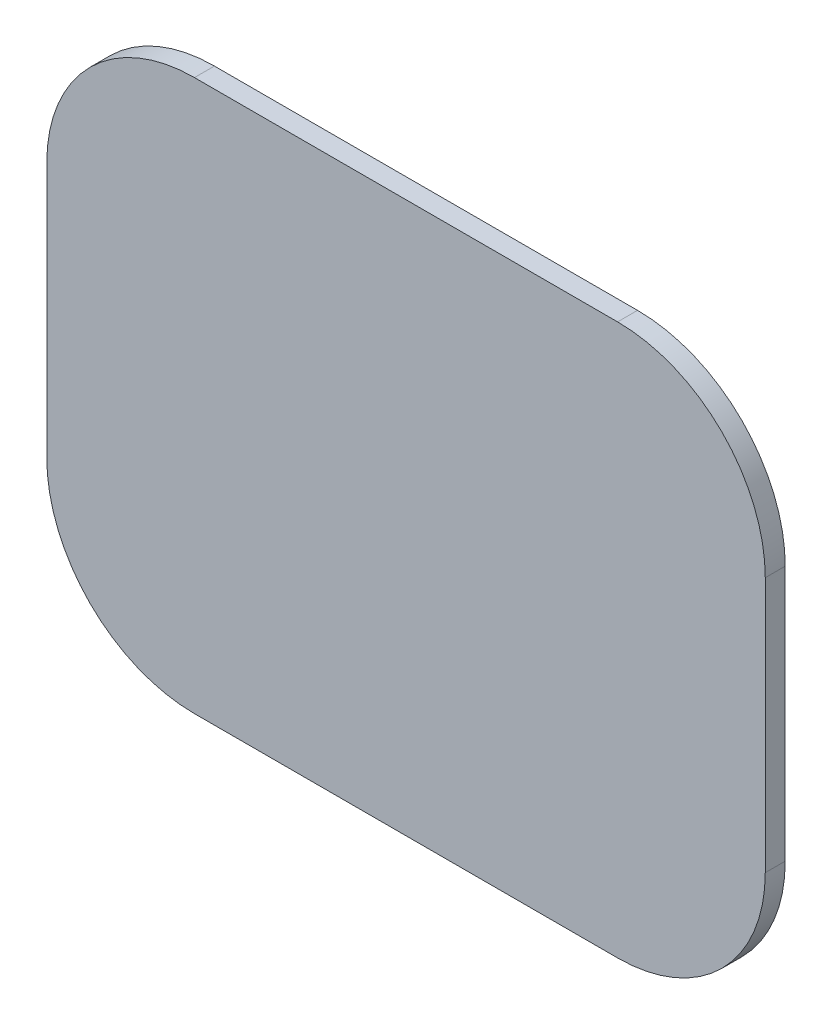
from build123d import *

# Parameters (mm, degrees)
BOSS_EXTRUDE1_START = 71.584968
BOSS_EXTRUDE1_DEPTH = 2.5
BOSS_EXTRUDE2_DEPTH = 2.5


with BuildPart() as part:
    # Sketch2 → Boss-Extrude1 (new body)
    with BuildSketch(Plane.XY.offset(-64.584967839).offset(BOSS_EXTRUDE1_START)):
        with BuildLine():
            Line((144.480934022, 643.250628573), (197.480934022, 643.250628573))
            ThreePointArc((197.480934022, 643.250628573), (210.562409474, 648.669153121), (215.980934022, 661.750628573))
            Line((215.980934022, 661.750628573), (215.980934022, 693.750628573))
            ThreePointArc((215.980934022, 693.750628573), (210.562409474, 706.832104025), (197.480934022, 712.250628573))
            Line((197.480934022, 712.250628573), (144.480934022, 712.250628573))
            ThreePointArc((144.480934022, 712.250628573), (131.39945857, 706.832104025), (125.980934022, 693.750628573))
            Line((125.980934022, 693.750628573), (125.980934022, 661.750628573))
            ThreePointArc((125.980934022, 661.750628573), (131.39945857, 648.669153121), (144.480934022, 643.250628573))
        make_face()
        with BuildLine():
            Line((144.480934022, 644.750628573), (197.480934022, 644.750628573))
            ThreePointArc((197.480934022, 644.750628573), (209.501749302, 649.729813293), (214.480934022, 661.750628573))
            Line((214.480934022, 661.750628573), (214.480934022, 693.750628573))
            ThreePointArc((214.480934022, 693.750628573), (209.501749302, 705.771443853), (197.480934022, 710.750628573))
            Line((197.480934022, 710.750628573), (144.480934022, 710.750628573))
            ThreePointArc((144.480934022, 710.750628573), (132.460118742, 705.771443853), (127.480934022, 693.750628573))
            Line((127.480934022, 693.750628573), (127.480934022, 661.750628573))
            ThreePointArc((127.480934022, 661.750628573), (132.460118742, 649.729813293), (144.480934022, 644.750628573))
        make_face(mode=Mode.SUBTRACT)
    extrude(amount=BOSS_EXTRUDE1_DEPTH)

    # Sketch3 → Boss-Extrude2 (add)
    with BuildSketch(Plane.XY.offset(7)):
        with BuildLine():
            Line((125.980934022, 693.750628573), (125.980934022, 661.750628573))
            ThreePointArc((125.980934022, 661.750628573), (131.39945857, 648.669153121), (144.480934022, 643.250628573))
            Line((144.480934022, 643.250628573), (197.480934022, 643.250628573))
            ThreePointArc((197.480934022, 643.250628573), (210.562409474, 648.669153121), (215.980934022, 661.750628573))
            Line((215.980934022, 661.750628573), (215.980934022, 693.750628573))
            ThreePointArc((215.980934022, 693.750628573), (210.562409474, 706.832104025), (197.480934022, 712.250628573))
            Line((197.480934022, 712.250628573), (144.480934022, 712.250628573))
            ThreePointArc((144.480934022, 712.250628573), (131.39945857, 706.832104025), (125.980934022, 693.750628573))
        make_face()
    extrude(amount=BOSS_EXTRUDE2_DEPTH)


solid = part.part
